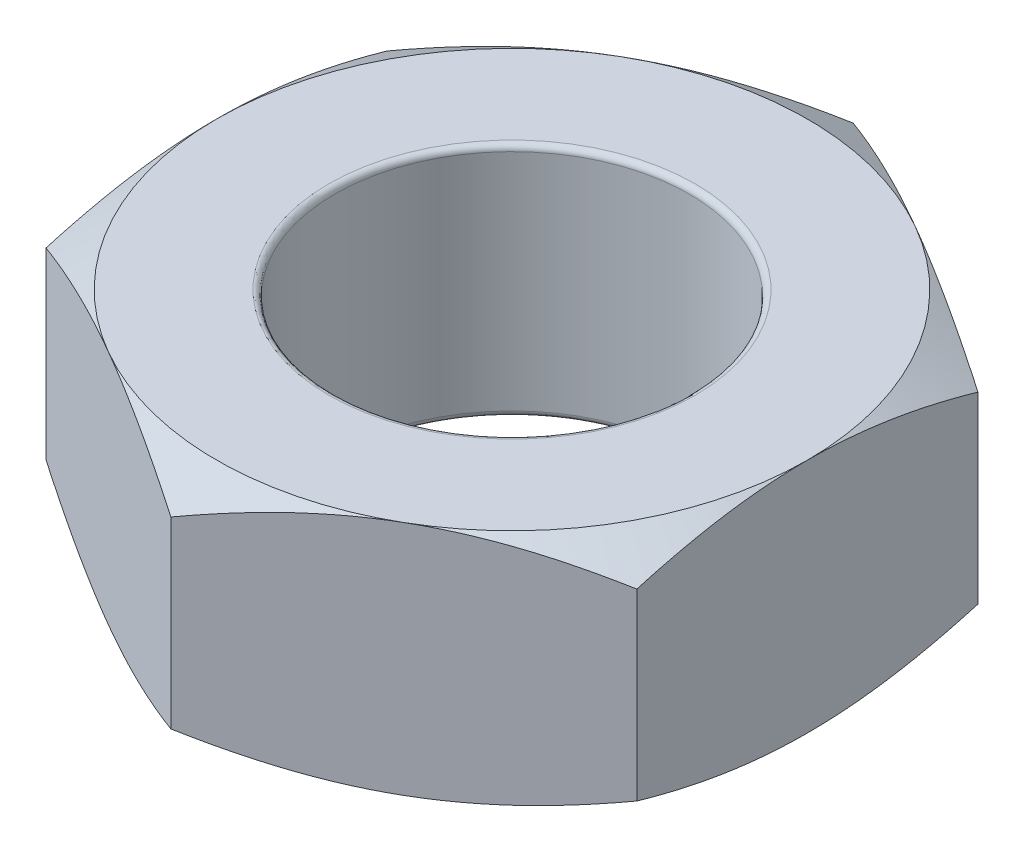
from build123d import *

# Parameters (mm, degrees)
SKETCH1_R           = 1.5
BOSS_EXTRUDE1_DEPTH = 2
SKETCH2_OUTSIDE_W   = 15.508
SKETCH2_OUTSIDE_H   = 16.282
SKETCH2_OUTSIDE_R   = 2.5
CUT_EXTRUDE1_DEPTH  = 2
CUT_EXTRUDE1_DRAFT  = -60
SKETCH3_OUTSIDE_W   = 15.508
SKETCH3_OUTSIDE_H   = 16.282
SKETCH3_OUTSIDE_R   = 2.5
CUT_EXTRUDE2_DEPTH  = 2
CUT_EXTRUDE2_DRAFT  = -60
FILLET1_R           = 0.05


with BuildPart() as part:
    # Sketch1 → Boss-Extrude1 (new body)
    with BuildSketch(Plane(origin=(0, 0, 0), x_dir=(1, 0, 0), z_dir=(0, 1, 0))):
        Polygon((0, 2.886751346), (-2.5, 1.443375673), (-2.5, -1.443375673), (0, -2.886751346), (2.5, -1.443375673), (2.5, 1.443375673), align=None)
        with Locations(Location((0, 0, 0), (0, 0, 270))):
            Circle(SKETCH1_R, mode=Mode.SUBTRACT)
    extrude(amount=BOSS_EXTRUDE1_DEPTH)


with BuildPart() as cut_extrude1_tool:
    # Sketch2 outside → Cut-Extrude1 (with draft: the straight prism first)
    with BuildSketch(Plane(origin=(0, 2, 0), x_dir=(1, 0, 0), z_dir=(0, 1, 0))):
        Rectangle(SKETCH2_OUTSIDE_W, SKETCH2_OUTSIDE_H)
        Circle(SKETCH2_OUTSIDE_R, mode=Mode.SUBTRACT)
    extrude(amount=-CUT_EXTRUDE1_DEPTH)
    # Cut-Extrude1: the draft: its side faces are tilted about the plane it starts from
    cut_extrude1_sides = [cut_extrude1_tool.faces().sort_by_distance(p)[0] for p in [
        (0, 1, 8.141),
        (7.754, 1, 0),
        (0, 1, -8.141),
        (-7.754, 1, 0),
        (-2.5, 1, 0),
    ]]
    draft(cut_extrude1_sides, Plane(origin=(0, 2, 0), x_dir=(1, 0, 0), z_dir=(0, 1, 0)), CUT_EXTRUDE1_DRAFT)


with BuildPart() as part_1:
    add(part.part)

    # Cut-Extrude1: cut by cut_extrude1_tool
    add(cut_extrude1_tool.part, mode=Mode.SUBTRACT)


with BuildPart() as cut_extrude2_tool:
    # Sketch3 outside → Cut-Extrude2 (with draft: the straight prism first)
    with BuildSketch(Plane.XZ):
        Rectangle(SKETCH3_OUTSIDE_W, SKETCH3_OUTSIDE_H)
        Circle(SKETCH3_OUTSIDE_R, mode=Mode.SUBTRACT)
    extrude(amount=-CUT_EXTRUDE2_DEPTH)
    # Cut-Extrude2: the draft: its side faces are tilted about the plane it starts from
    cut_extrude2_sides = [cut_extrude2_tool.faces().sort_by_distance(p)[0] for p in [
        (0, 1, -8.141),
        (7.754, 1, 0),
        (0, 1, 8.141),
        (-7.754, 1, 0),
        (-2.5, 1, 0),
    ]]
    draft(cut_extrude2_sides, Plane.XZ, CUT_EXTRUDE2_DRAFT)


with BuildPart() as part_2:
    add(part_1.part)

    # Cut-Extrude2: cut by cut_extrude2_tool
    add(cut_extrude2_tool.part, mode=Mode.SUBTRACT)

    # Fillet1
    fillet1_edges = [part_2.edges().sort_by_distance(p)[0] for p in [
        (0, 0, -1.5),
        (0, 2, -1.5),
    ]]
    fillet(fillet1_edges, radius=FILLET1_R)


solid = part_2.part
